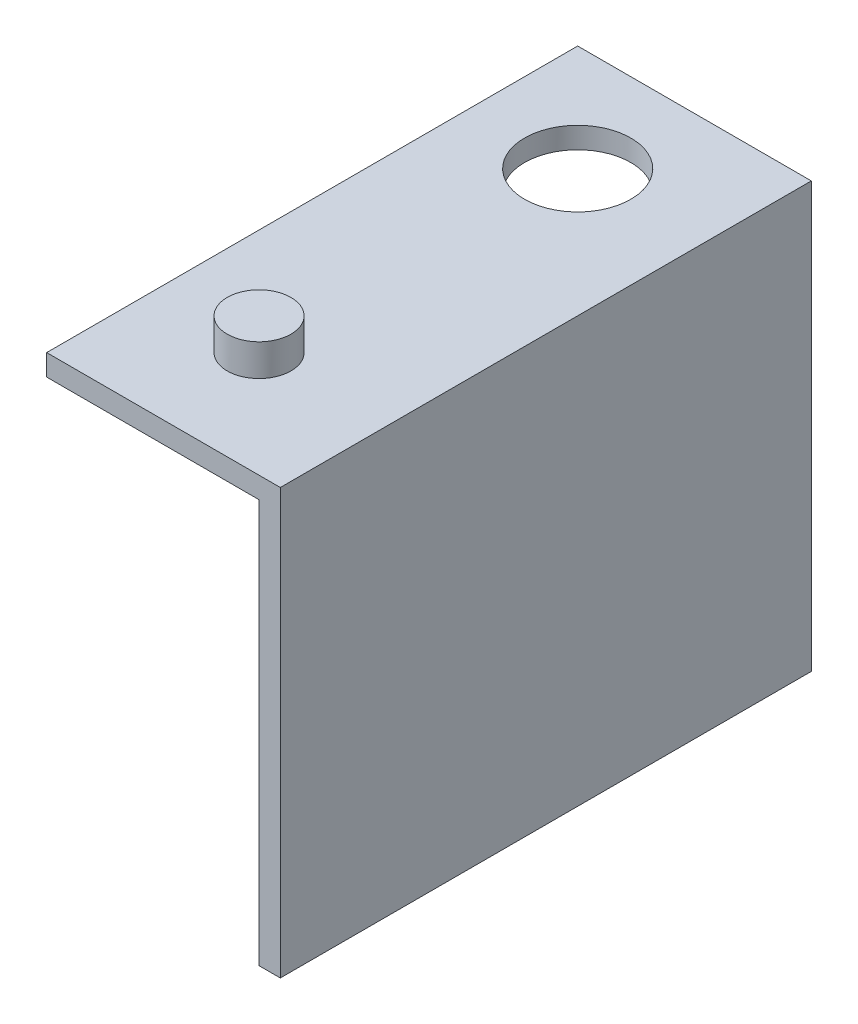
from build123d import *

# Parameters (mm, degrees)
SALIENTE_EXTRUIR1_DEPTH = 50
CORTAR_EXTRUIR1_REACH   = 69.705
CROQUIS2_R              = 5
CROQUIS3_R              = 3
SALIENTE_EXTRUIR2_DEPTH = 3


with BuildPart() as part:
    # Croquis1 → Saliente-Extruir1 (new body)
    with BuildSketch(Plane.XY):
        Polygon((0, 0), (0, 2), (22, 2), (22, -38), (20, -38), (20, 0), align=None)
    extrude(amount=SALIENTE_EXTRUIR1_DEPTH)

    # Croquis2 → Cortar-Extruir1 (cut, up to next)
    with BuildSketch(Plane(origin=(0, 2, 0), x_dir=(1, 0, 0), z_dir=(0, 1, 0)), mode=Mode.PRIVATE) as cortar_extruir1_sk1:
        with Locations(Location((10, -10, 0), (0, 0, 270))):
            Circle(CROQUIS2_R)
    cortar_extruir1_tool1 = extrude(cortar_extruir1_sk1.sketch, amount=-CORTAR_EXTRUIR1_REACH, mode=Mode.PRIVATE) & part.part
    add(cortar_extruir1_tool1.solids().sort_by_distance((10, 2, 10))[0], mode=Mode.SUBTRACT)

    # Croquis3 → Saliente-Extruir2 (add)
    with BuildSketch(Plane(origin=(0, 2, 0), x_dir=(1, 0, 0), z_dir=(0, 1, 0))):
        with Locations(Location((10, -40, 0), (0, 0, 90))):
            Circle(CROQUIS3_R)
    extrude(amount=SALIENTE_EXTRUIR2_DEPTH)


solid = part.part
